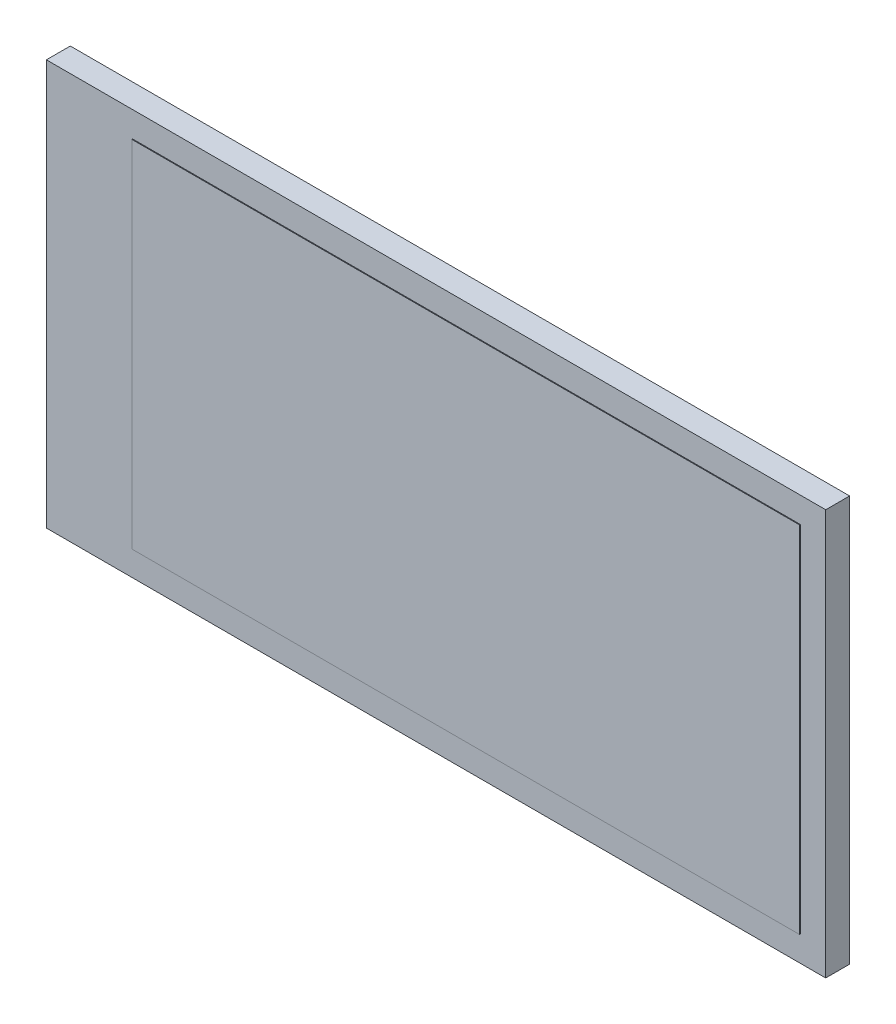
from build123d import *

# Parameters (mm, degrees)
ESQUISSE1_W        = 49.87
ESQUISSE1_H        = 25.95
BOSS_EXTRU_1_DEPTH = 1.53
ESQUISSE2_W        = 42.72
ESQUISSE2_H        = 22.7
BOSS_EXTRU_2_DEPTH = 0.05


with BuildPart() as part:
    # Esquisse1 → Boss.-Extru.1 (new body)
    with BuildSketch(Plane.XY):
        Rectangle(ESQUISSE1_W, ESQUISSE1_H)
    extrude(amount=BOSS_EXTRU_1_DEPTH)

    # Esquisse2 → Boss.-Extru.2 (add)
    with BuildSketch(Plane.XY.offset(1.53)):
        with Locations((1.946866865, -0.001912159)):
            Rectangle(ESQUISSE2_W, ESQUISSE2_H)
    extrude(amount=BOSS_EXTRU_2_DEPTH)


solid = part.part
